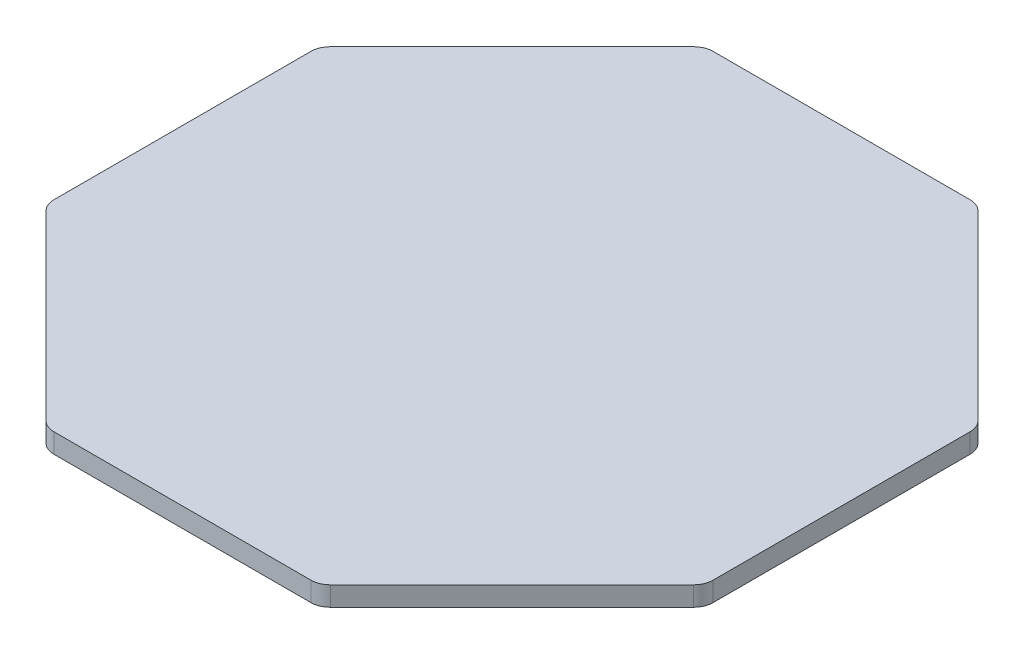
from build123d import *

# Parameters (mm, degrees)
BOSS_EXTRUDE1_DEPTH = 2
FILLET1_R           = 2


with BuildPart() as part:
    # Sketch1 → Boss-Extrude1 (new body)
    with BuildSketch(Plane(origin=(0, 0, 0), x_dir=(1, 0, 0), z_dir=(0, 1, 0))):
        Polygon((-14, 33.798989873), (14, 33.798989873), (33.798989873, 14), (33.798989873, -14), (14, -33.798989873), (-14, -33.798989873), (-33.798989873, -14), (-33.798989873, 14), align=None)
    extrude(amount=BOSS_EXTRUDE1_DEPTH)

    # Fillet1
    fillet1_edges = [part.edges().sort_by_distance(p)[0] for p in [
        (-14, 1, -33.798989873),
        (14, 1, -33.798989873),
        (33.798989873, 1, -14),
        (33.798989873, 1, 14),
        (14, 1, 33.798989873),
        (-14, 1, 33.798989873),
        (-33.798989873, 1, 14),
        (-33.798989873, 1, -14),
    ]]
    fillet(fillet1_edges, radius=FILLET1_R)


solid = part.part
